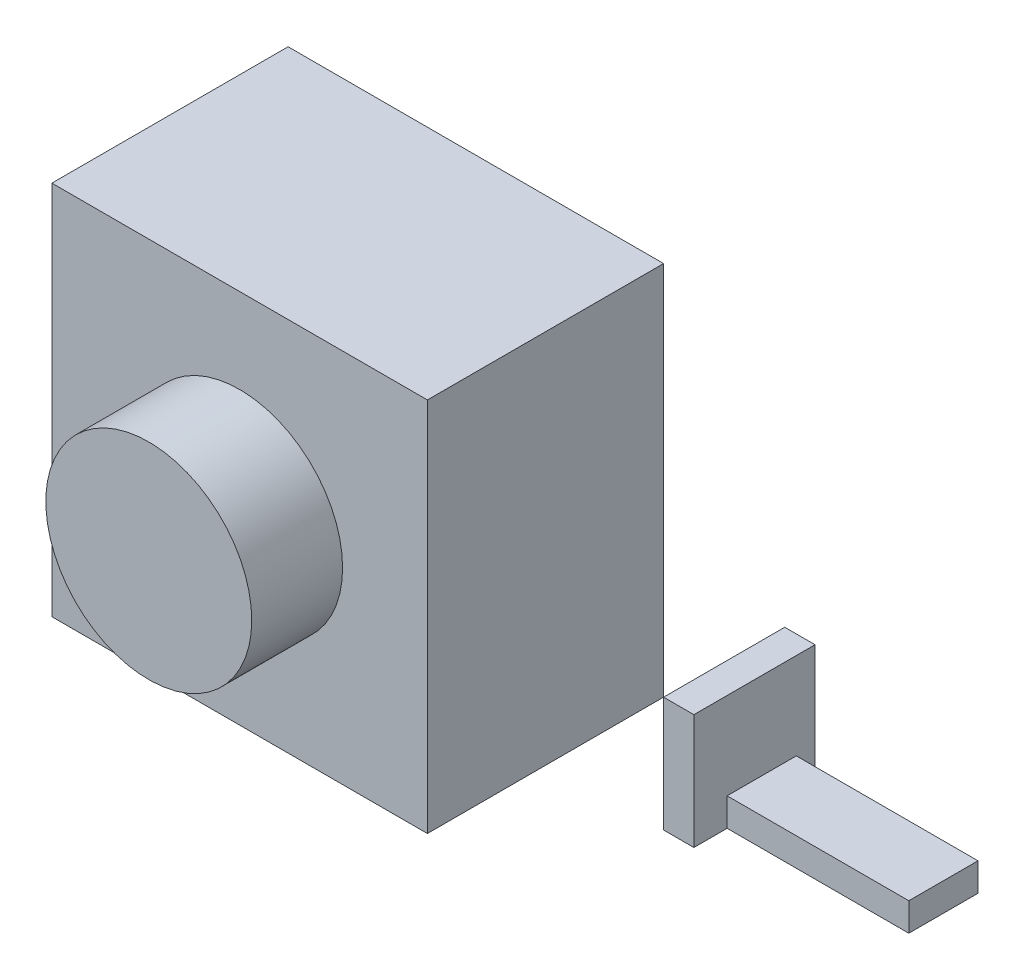
from build123d import *

# Parameters (mm, degrees)
SKETCH1_W             = 6.2
SKETCH1_H             = 3.9
BOSS_EXTRUDE1_DEPTH   = 6.2
SKETCH2_R             = 1.7
BOSS_EXTRUDE2_DEPTH   = 1.5
SKETCH3_W             = 0.5
SKETCH3_H             = 2
BOSS_EXTRUDE3_DEPTH   = 1.9
BOSS_EXTRUDE3_2_DEPTH = 1.9
SKETCH4_W             = 1.14226937
SKETCH4_H             = 0.464957119
BOSS_EXTRUDE4_DEPTH   = 3


with BuildPart() as part:
    # Sketch1 → Boss-Extrude1 (new body)
    with BuildSketch(Plane(origin=(0, 0, 0), x_dir=(1, 0, 0), z_dir=(0, 1, 0))):
        Rectangle(SKETCH1_W, SKETCH1_H)
    extrude(amount=BOSS_EXTRUDE1_DEPTH)

    # Sketch2 → Boss-Extrude2 (add)
    with BuildSketch(Plane.XY.offset(1.95)):
        with Locations((0, 3.1)):
            Circle(SKETCH2_R)
    extrude(amount=BOSS_EXTRUDE2_DEPTH)


with BuildPart() as body_2:
    # Sketch3 → Boss-Extrude3 (new body)
    with BuildSketch(Plane.XZ):
        with Locations((3.35, -2.95)):
            Rectangle(SKETCH3_W, SKETCH3_H)
    extrude(amount=BOSS_EXTRUDE3_DEPTH)

    # Sketch4 → Boss-Extrude4 (add)
    with BuildSketch(Plane(origin=(3.6, 0, 0), x_dir=(0, 0, -1), z_dir=(1, 0, 0))):
        with Locations((3.069659625, -1.667521441)):
            Rectangle(SKETCH4_W, SKETCH4_H)
    extrude(amount=BOSS_EXTRUDE4_DEPTH)


with BuildPart() as body_3:
    # Sketch3 → Boss-Extrude3 2 (new body)
    with BuildSketch(Plane.XZ):
        with Locations((-3.35, -2.95)):
            Rectangle(SKETCH3_W, SKETCH3_H)
    extrude(amount=BOSS_EXTRUDE3_2_DEPTH)


solid = Compound([part.part, body_2.part, body_3.part])
